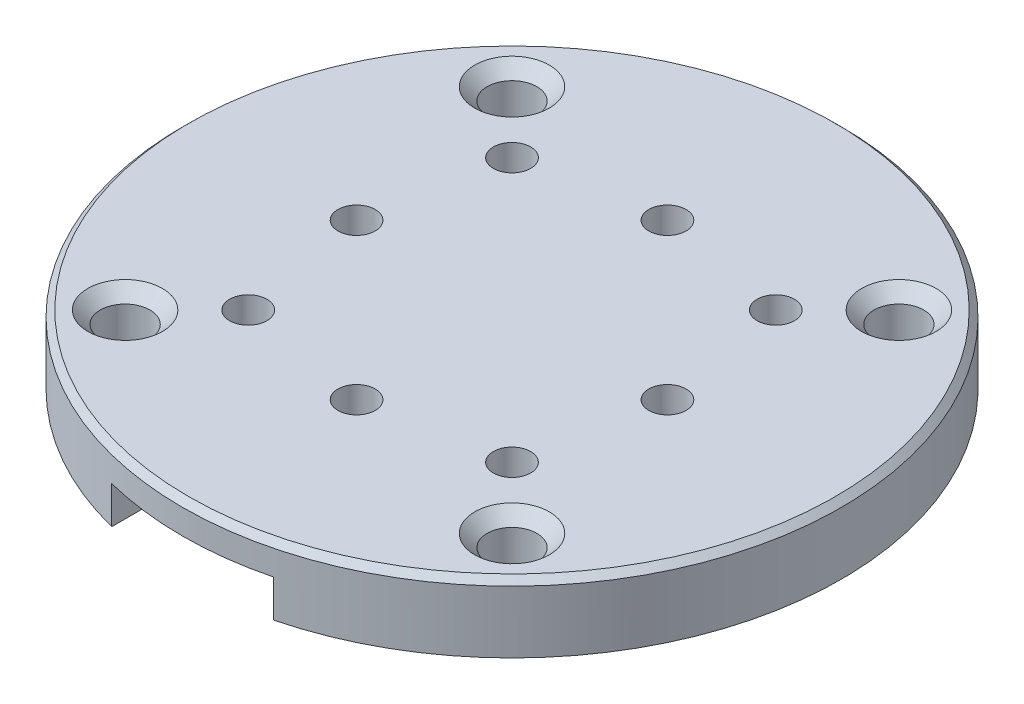
from build123d import *

# Parameters (mm, degrees)
SKETCH_1_R          = 26.5
EXTRUDE_1_DEPTH     = 5.5
CHAMFER_1_SIZE      = 0.5
SKETCH_4_R          = 2
CUT_EXTRUDE_2_DEPTH = 38.878093933
CHAMFER_2_SIZE      = 1
SKETCH_5_R          = 1.5
CUT_EXTRUDE_3_DEPTH = 38.878093933
CUT_EXTRUDE_4_DEPTH = 3


with BuildPart() as part:
    # Эскиз1 → Бобышка-Вытянуть1 (new body)
    with BuildSketch(Plane(origin=(0, 0, 0), x_dir=(1, 0, 0), z_dir=(0, 1, 0))):
        with Locations(Location((0, 0, 0), (0, 0, 270))):
            Circle(SKETCH_1_R)
    extrude(amount=EXTRUDE_1_DEPTH)

    # Фаска1
    chamfer_1_edges = [part.edges().sort_by_distance(p)[0] for p in [
        (0, 5.5, -26.5),
    ]]
    chamfer(chamfer_1_edges, length=CHAMFER_1_SIZE)

    # Эскиз4 → Вырез-Вытянуть2 (cut, through all)
    with BuildSketch(Plane(origin=(0, 5.5, 0), x_dir=(1, 0, 0), z_dir=(0, 1, 0))):
        with Locations(Location((-15.556349186, 15.556349186, 0), (0, 0, 270))):
            Circle(SKETCH_4_R)
        with Locations(Location((15.556349186, 15.556349186, 0), (0, 0, 270))):
            Circle(SKETCH_4_R)
        with Locations(Location((15.556349186, -15.556349186, 0), (0, 0, 270))):
            Circle(SKETCH_4_R)
        with Locations(Location((-15.556349186, -15.556349186, 0), (0, 0, 270))):
            Circle(SKETCH_4_R)
    extrude(amount=-CUT_EXTRUDE_2_DEPTH, mode=Mode.SUBTRACT)

    # Фаска2
    chamfer_2_edges = [part.edges().sort_by_distance(p)[0] for p in [
        (-15.556349186, 5.5, 13.556349186),
        (15.556349186, 5.5, 13.556349186),
        (15.556349186, 5.5, -17.556349186),
        (-15.556349186, 5.5, -17.556349186),
    ]]
    chamfer(chamfer_2_edges, length=CHAMFER_2_SIZE)

    # Эскиз5 → Вырез-Вытянуть3 (cut, through all)
    with BuildSketch(Plane(origin=(0, 5.5, 0), x_dir=(1, 0, 0), z_dir=(0, 1, 0))):
        with Locations(Location((0, 12.5, 0), (0, 0, 270))):
            Circle(SKETCH_5_R)
        with Locations(Location((12.5, 0, 0), (0, 0, 270))):
            Circle(SKETCH_5_R)
        with Locations(Location((0, -12.5, 0), (0, 0, 270))):
            Circle(SKETCH_5_R)
        with Locations(Location((-12.5, 0, 0), (0, 0, 270))):
            Circle(SKETCH_5_R)
        with Locations(Location((10.606601718, 10.606601718, 0), (0, 0, 270))):
            Circle(SKETCH_5_R)
        with Locations(Location((10.606601718, -10.606601718, 0), (0, 0, 270))):
            Circle(SKETCH_5_R)
        with Locations(Location((-10.606601718, -10.606601718, 0), (0, 0, 270))):
            Circle(SKETCH_5_R)
        with Locations(Location((-10.606601718, 10.606601718, 0), (0, 0, 270))):
            Circle(SKETCH_5_R)
    extrude(amount=-CUT_EXTRUDE_3_DEPTH, mode=Mode.SUBTRACT)

    # Эскиз6 → Вырез-Вытянуть4 (cut)
    with BuildSketch(Plane.XZ):
        with BuildLine():
            Line((6.5, 6.92820323), (6.5, 25.690465157))
            ThreePointArc((6.5, 25.690465157), (0, 26.5), (-6.5, 25.690465157))
            Line((-6.5, 25.690465157), (-6.5, 6.92820323))
            ThreePointArc((-6.5, 6.92820323), (0, -9.5), (6.5, 6.92820323))
        make_face()
    extrude(amount=-CUT_EXTRUDE_4_DEPTH, mode=Mode.SUBTRACT)


solid = part.part
